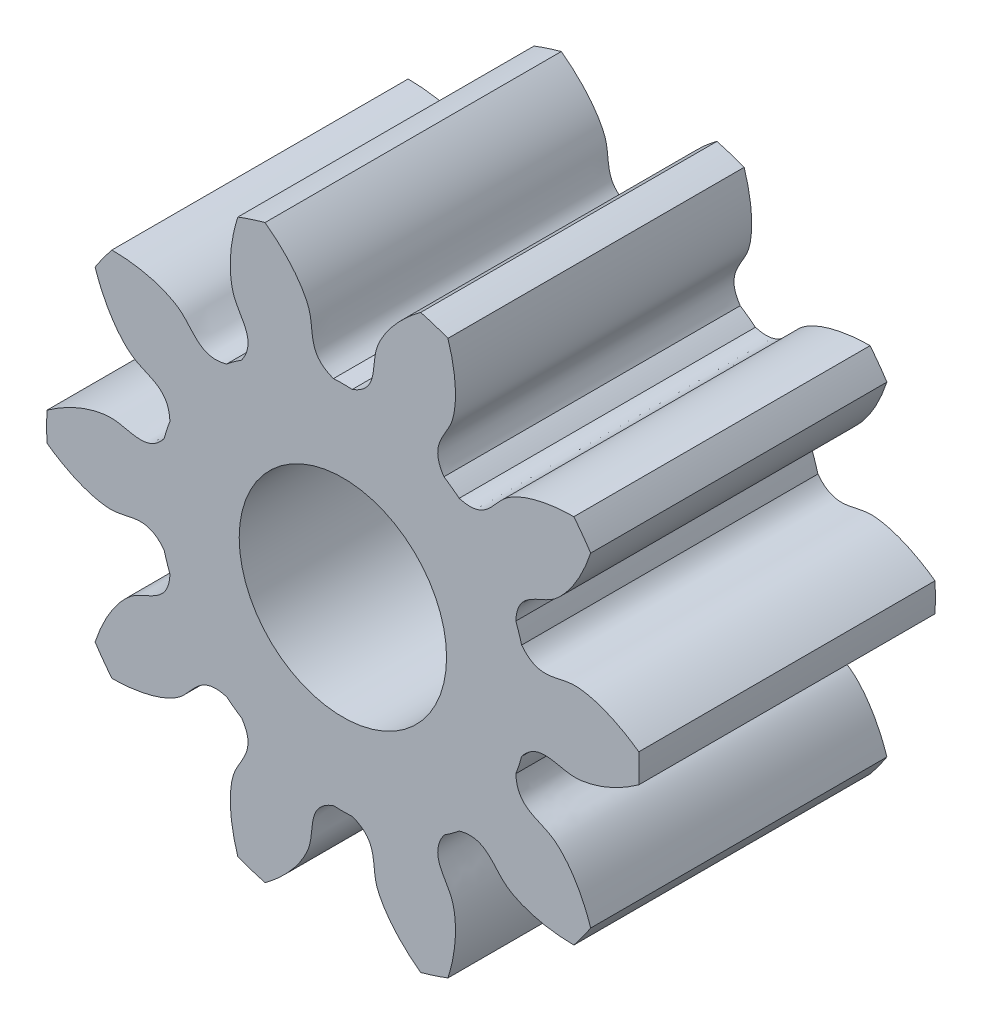
from build123d import *

# Parameters (mm, degrees)
SKETCH_1_R               = 3
EXTRUDE_1_DEPTH          = 3
CUT_EXTRUDE_1_DEPTH      = 6.196152423
PATTERN_CIRCULAR_1_COUNT = 10
CUT_EXTRUDE_2_REACH      = 7.136
SKETCH_4_R               = 1.05


with BuildPart() as part:
    # 草图1 → 凸台-拉伸1 (new body)
    with BuildSketch(Plane.XY):
        Circle(SKETCH_1_R)
    extrude(amount=EXTRUDE_1_DEPTH)

    # 草图2 → 切除-拉伸1 (cut, through all)
    with BuildSketch(Plane.XY):
        with BuildLine():
            ThreePointArc((0.095229133, 1.872580148), (0, 1.875), (-0.095229133, 1.872580148))
            add(Edge.make_bspline(
                [(-0.095229133, 1.872580148), (-0.362715165, 1.970284093), (-0.286920777, 2.185294723), (-0.344330803, 2.362336277), (-0.347251515, 2.37077245), (-0.350665635, 2.380030264), (-0.35460634, 2.390093167), (-0.359107284, 2.400943399), (-0.364201322, 2.412562246), (-0.369920867, 2.424929978), (-0.376297744, 2.438025881), (-0.383363205, 2.451828275), (-0.391147884, 2.466314521), (-0.399681784, 2.481461042), (-0.408994243, 2.497243338), (-0.419113912, 2.513636003), (-0.430068732, 2.530612743), (-0.441885908, 2.548146397), (-0.454591887, 2.566208951), (-0.468212335, 2.58477156), (-0.482772111, 2.603804571), (-0.498295251, 2.623277538), (-0.514804941, 2.64315925), (-0.532323498, 2.663417745), (-0.550872351, 2.68402034), (-0.570472019, 2.704933651), (-0.591142092, 2.726123613), (-0.612901212, 2.747555509), (-0.635767055, 2.769193992), (-0.659756316, 2.79100311), (-0.684884687, 2.812946332), (-0.711166843, 2.834986573), (-0.73861643, 2.857086218), (-0.767246042, 2.879207155), (-0.797067213, 2.901310796), (-0.828090401, 2.923358104), (-0.860324974, 2.945309627), (-0.8937792, 2.967125519), (-0.928460232, 2.988765572), (-0.964374099, 3.010189244), (-1.001525696, 3.031355689), (-1.039918773, 3.052223783), (-1.079555927, 3.072752157), (-1.120438592, 3.092899225), (-1.162567035, 3.112623216), (-1.205940346, 3.131882201), (-1.250556433, 3.150634125), (-1.296412017, 3.168836838), (-1.343502628, 3.186448125), (-1.3918226, 3.203425737), (-1.441365068, 3.219727424), (-1.492121969, 3.235310961), (-1.544084033, 3.250134185), (-1.597240793, 3.264155023), (-1.651580574, 3.277331523), (-1.707090504, 3.289621887), (-1.763756505, 3.300984501), (-1.821563307, 3.311377967), (-1.880494441, 3.320761135), (-1.940532246, 3.329093134), (-2.022655253, 3.338820511), (-2.084917451, 3.344293469), (-2.126793313, 3.34714445)],
                knots=[0, 0, 0, 0, 0.201720712, 0.204696754, 0.208022917, 0.211699204, 0.215725612, 0.220102144, 0.224828797, 0.229905574, 0.235332472, 0.241109493, 0.247236637, 0.253713903, 0.260541292, 0.267718803, 0.275246437, 0.283124193, 0.291352071, 0.299930073, 0.308858196, 0.318136442, 0.327764811, 0.337743302, 0.348071916, 0.358750652, 0.36977951, 0.381158491, 0.392887595, 0.404966821, 0.41739617, 0.430175641, 0.443305234, 0.45678495, 0.470614789, 0.48479475, 0.499324833, 0.514205039, 0.529435368, 0.545015819, 0.560946392, 0.577227088, 0.593857907, 0.610838848, 0.628169911, 0.645851097, 0.663882406, 0.682263837, 0.70099539, 0.720077066, 0.739508864, 0.759290785, 0.779422829, 0.799904995, 0.820737283, 0.841919694, 0.863452227, 0.885334883, 0.907567662, 0.930150562, 0.953083586, 1, 1, 1, 1], degree=3))
            ThreePointArc((-2.126793313, 3.34714445), (0, 3.965680996), (2.126793313, 3.34714445))
            add(Edge.make_bspline(
                [(0.095229133, 1.872580148), (0.362715165, 1.970284093), (0.286920777, 2.185294723), (0.344330803, 2.362336277), (0.347251515, 2.37077245), (0.350665635, 2.380030264), (0.35460634, 2.390093167), (0.359107284, 2.400943399), (0.364201322, 2.412562246), (0.369920867, 2.424929978), (0.376297744, 2.438025881), (0.383363205, 2.451828275), (0.391147884, 2.466314521), (0.399681784, 2.481461042), (0.408994243, 2.497243338), (0.419113912, 2.513636003), (0.430068732, 2.530612743), (0.441885908, 2.548146397), (0.454591887, 2.566208951), (0.468212335, 2.58477156), (0.482772111, 2.603804571), (0.498295251, 2.623277538), (0.514804941, 2.64315925), (0.532323498, 2.663417745), (0.550872351, 2.68402034), (0.570472019, 2.704933651), (0.591142092, 2.726123613), (0.612901212, 2.747555509), (0.635767055, 2.769193992), (0.659756316, 2.79100311), (0.684884687, 2.812946332), (0.711166843, 2.834986573), (0.73861643, 2.857086218), (0.767246042, 2.879207155), (0.797067213, 2.901310796), (0.828090401, 2.923358104), (0.860324974, 2.945309627), (0.8937792, 2.967125519), (0.928460232, 2.988765572), (0.964374099, 3.010189244), (1.001525696, 3.031355689), (1.039918773, 3.052223783), (1.079555927, 3.072752157), (1.120438592, 3.092899225), (1.162567035, 3.112623216), (1.205940346, 3.131882201), (1.250556433, 3.150634125), (1.296412017, 3.168836838), (1.343502628, 3.186448125), (1.3918226, 3.203425737), (1.441365068, 3.219727424), (1.492121969, 3.235310961), (1.544084033, 3.250134185), (1.597240793, 3.264155023), (1.651580574, 3.277331523), (1.707090504, 3.289621887), (1.763756505, 3.300984501), (1.821563307, 3.311377967), (1.880494441, 3.320761135), (1.940532246, 3.329093134), (2.022655253, 3.338820511), (2.084917451, 3.344293469), (2.126793313, 3.34714445)],
                knots=[0, 0, 0, 0, 0.201720712, 0.204696754, 0.208022917, 0.211699204, 0.215725612, 0.220102144, 0.224828797, 0.229905574, 0.235332472, 0.241109493, 0.247236637, 0.253713903, 0.260541292, 0.267718803, 0.275246437, 0.283124193, 0.291352071, 0.299930073, 0.308858196, 0.318136442, 0.327764811, 0.337743302, 0.348071916, 0.358750652, 0.36977951, 0.381158491, 0.392887595, 0.404966821, 0.41739617, 0.430175641, 0.443305234, 0.45678495, 0.470614789, 0.48479475, 0.499324833, 0.514205039, 0.529435368, 0.545015819, 0.560946392, 0.577227088, 0.593857907, 0.610838848, 0.628169911, 0.645851097, 0.663882406, 0.682263837, 0.70099539, 0.720077066, 0.739508864, 0.759290785, 0.779422829, 0.799904995, 0.820737283, 0.841919694, 0.863452227, 0.885334883, 0.907567662, 0.930150562, 0.953083586, 1, 1, 1, 1], degree=3))
        make_face()
    cut_extrude_1 = extrude(amount=CUT_EXTRUDE_1_DEPTH, mode=Mode.SUBTRACT)

    # 阵列(圆周)1: 切除-拉伸1 ×10 about axis
    pattern_circular_1_axis = Axis((0, 0, -0.3), (0, 0, 1))
    for i in range(1, PATTERN_CIRCULAR_1_COUNT):
        add(cut_extrude_1.rotate(pattern_circular_1_axis, i * 360 / PATTERN_CIRCULAR_1_COUNT), mode=Mode.SUBTRACT)

    # 草图4 → 切除-拉伸2 (cut, up to next)
    with BuildSketch(Plane(origin=(0, 0, 0), x_dir=(-1, 0, 0), z_dir=(0, 0, -1)), mode=Mode.PRIVATE) as cut_extrude_2_sk1:
        Circle(SKETCH_4_R)
    cut_extrude_2_tool1 = extrude(cut_extrude_2_sk1.sketch, amount=-CUT_EXTRUDE_2_REACH, mode=Mode.PRIVATE) & part.part
    add(cut_extrude_2_tool1.solids().sort_by_distance((0, 0, 0))[0], mode=Mode.SUBTRACT)


solid = part.part
